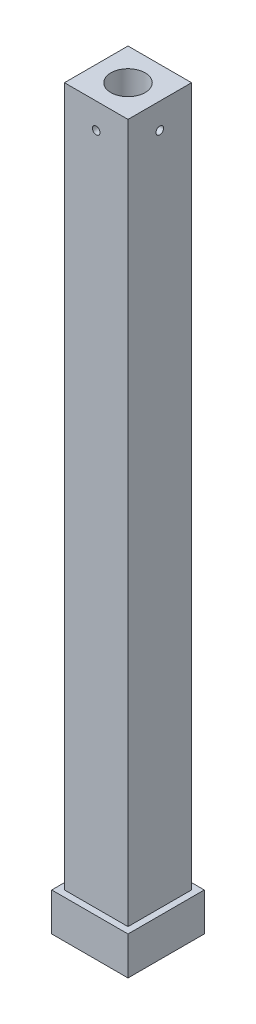
from build123d import *

# Parameters (mm, degrees)
SKETCH_1_W          = 5
SKETCH_1_H          = 5
EXTRUDE_1_DEPTH     = 58
SKETCH_1_5_W        = 6
SKETCH_1_5_H        = 6
EXTRUDE_2_DEPTH     = 3
SKETCH_1_3_R        = 1.35
CUT_EXTRUDE_1_DEPTH = 59.154965394
CUT_EXTRUDE_2_DEPTH = 2
SKETCH_3_R          = 0.3
CUT_EXTRUDE_3_DEPTH = 59.337380812
SKETCH_4_R          = 0.3
CUT_EXTRUDE_4_DEPTH = 59.337380911


with BuildPart() as part:
    # 草图1 → 凸台-拉伸1 (new body)
    with BuildSketch(Plane(origin=(0, 0, 0), x_dir=(1, 0, 0), z_dir=(0, 1, 0))):
        Rectangle(SKETCH_1_W, SKETCH_1_H)
    extrude(amount=EXTRUDE_1_DEPTH)

    # 草图1<5> → 凸台-拉伸2 (add)
    with BuildSketch(Plane(origin=(0, 0, 0), x_dir=(1, 0, 0), z_dir=(0, 1, 0))):
        Rectangle(SKETCH_1_5_W, SKETCH_1_5_H)
    extrude(amount=EXTRUDE_2_DEPTH)

    # 草图1<3> → 切除-拉伸1 (cut, through all)
    with BuildSketch(Plane(origin=(0, 0, 0), x_dir=(1, 0, 0), z_dir=(0, 1, 0))):
        Circle(SKETCH_1_3_R)
    extrude(amount=CUT_EXTRUDE_1_DEPTH, mode=Mode.SUBTRACT)

    # 草图1<4> → 切除-拉伸2 (cut)
    with BuildSketch(Plane(origin=(0, 0, 0), x_dir=(1, 0, 0), z_dir=(0, 1, 0))):
        Polygon((2.886751346, 0), (1.443375673, 2.5), (-1.443375673, 2.5), (-2.886751346, 0), (-1.443375673, -2.5), (1.443375673, -2.5), align=None)
    extrude(amount=CUT_EXTRUDE_2_DEPTH, mode=Mode.SUBTRACT)

    # 草图3 → 切除-拉伸3 (cut, through all)
    with BuildSketch(Plane.XY.offset(2.5)):
        with Locations((0, 56)):
            Circle(SKETCH_3_R)
    extrude(amount=-CUT_EXTRUDE_3_DEPTH, mode=Mode.SUBTRACT)

    # 草图4 → 切除-拉伸4 (cut, through all)
    with BuildSketch(Plane.ZY.offset(2.5)):
        with Locations((0, 56)):
            Circle(SKETCH_4_R)
    extrude(amount=-CUT_EXTRUDE_4_DEPTH, mode=Mode.SUBTRACT)


solid = part.part
